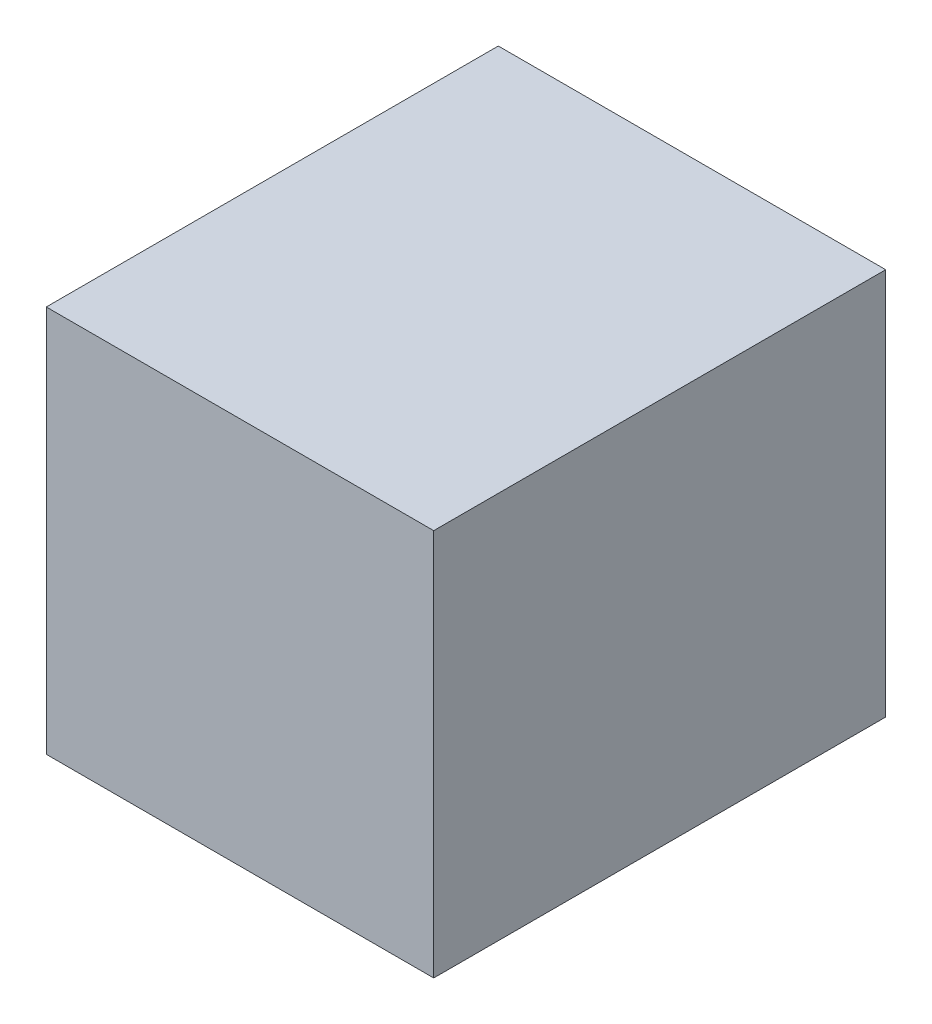
from build123d import *

# Parameters (mm, degrees)
SKETCH_1_W      = 60
SKETCH_1_H      = 60
EXTRUDE_1_DEPTH = 70


with BuildPart() as part:
    # 草图1 → 凸台-拉伸1 (new body)
    with BuildSketch(Plane.XY):
        Rectangle(SKETCH_1_W, SKETCH_1_H)
    extrude(amount=EXTRUDE_1_DEPTH)


solid = part.part
